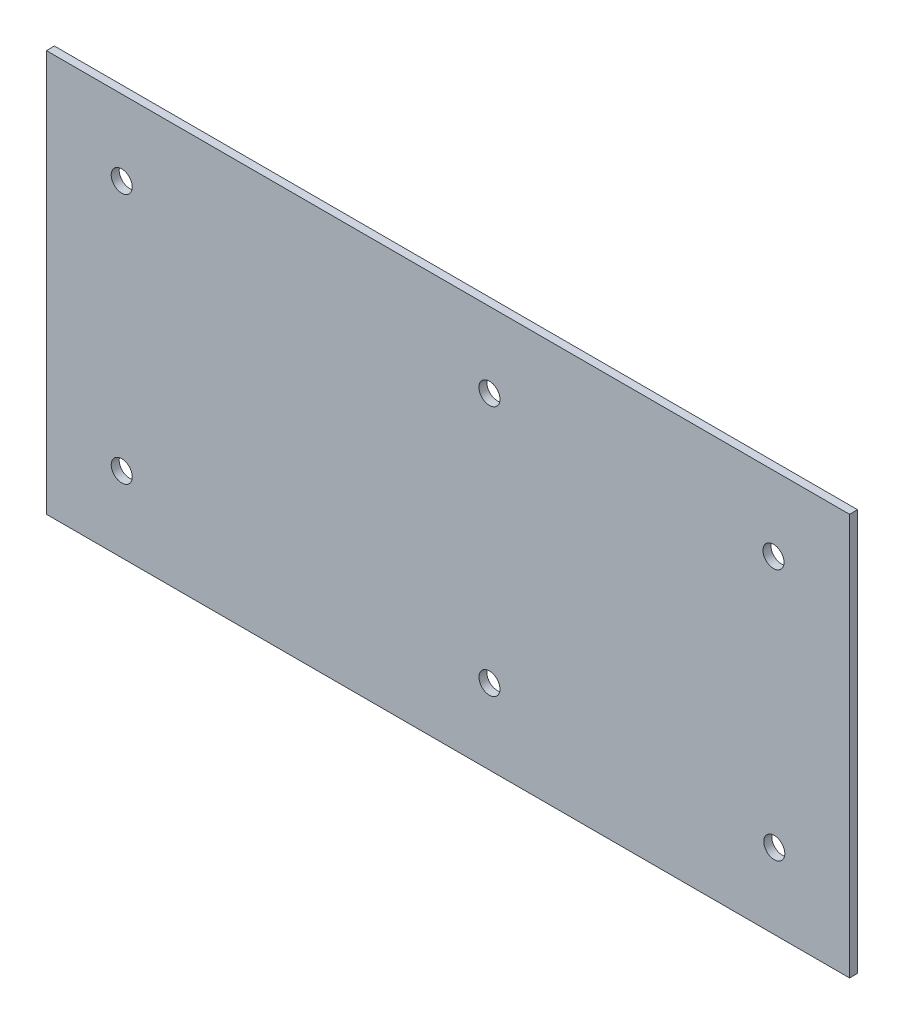
from build123d import *

# Parameters (mm, degrees)
SKETCH1_W           = 160.00248
SKETCH1_H           = 80.00248
SKETCH1_R           = 2.0955
BOSS_EXTRUDE1_DEPTH = 1.5875


with BuildPart() as part:
    # Sketch1 → Boss-Extrude1 (new body)
    with BuildSketch(Plane.XY):
        with Locations((32.267241011, -1.925411501)):
            Rectangle(SKETCH1_W, SKETCH1_H)
        with Locations((-32.732758989, 23.074588499)):
            Circle(SKETCH1_R, mode=Mode.SUBTRACT)
        with Locations((-32.732758989, -26.925411501)):
            Circle(SKETCH1_R, mode=Mode.SUBTRACT)
        with Locations((40.517241011, 23.074588499)):
            Circle(SKETCH1_R, mode=Mode.SUBTRACT)
        with Locations((97.108533989, 23.233295522)):
            Circle(SKETCH1_R, mode=Mode.SUBTRACT)
        with Locations((40.517241011, -26.925411501)):
            Circle(SKETCH1_R, mode=Mode.SUBTRACT)
        with Locations((97.267241011, -26.925411501)):
            Circle(SKETCH1_R, mode=Mode.SUBTRACT)
    extrude(amount=BOSS_EXTRUDE1_DEPTH)


solid = part.part
